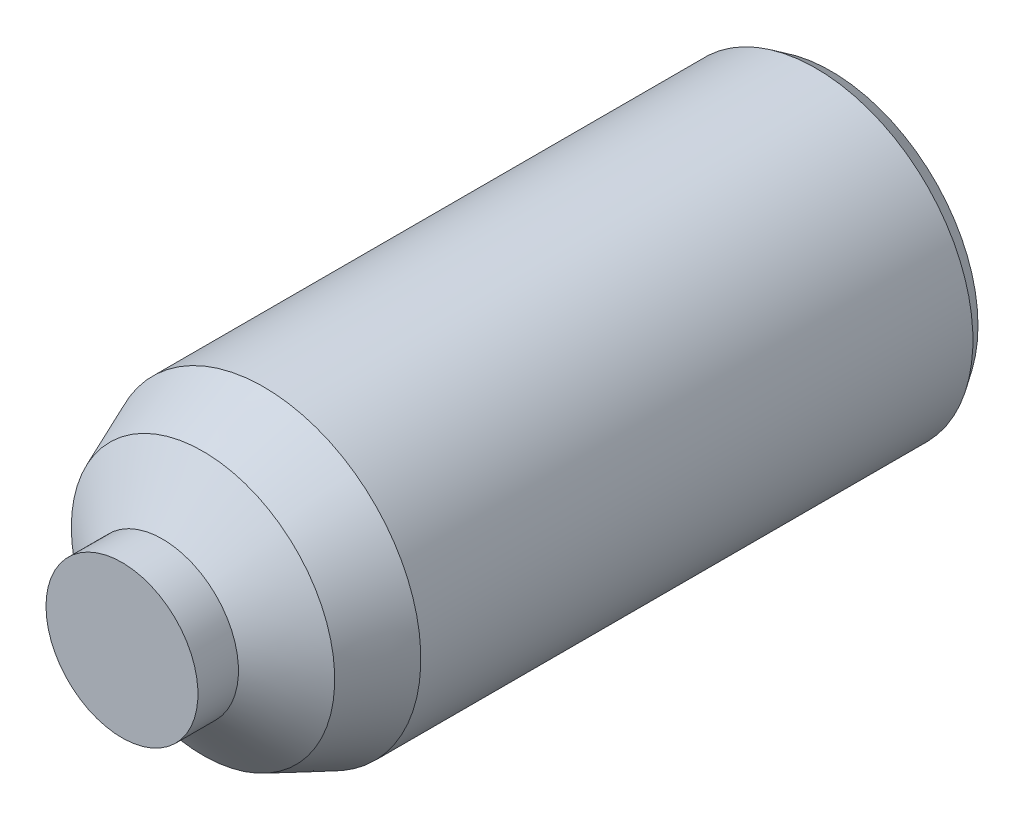
from build123d import *


with BuildPart() as part:
    # Revolve profile 1 → Revolve 1 (revolve)
    with BuildSketch(Plane(origin=(0, 0, 0), x_dir=(1, 0, 0), z_dir=(0, 1, 0)), mode=Mode.PRIVATE) as revolve_1_sk:
        Polygon((0, -140), (0, 0), (29, 0), (31, -3), (31, -112), (26, -124), (15, -132), (15, -140), align=None)
    revolve(revolve_1_sk.sketch.rotate(Axis((0, 0, -5), (0, 0, 1)), 180), axis=Axis((0, 0, -5), (0, 0, 1)))


solid = part.part
